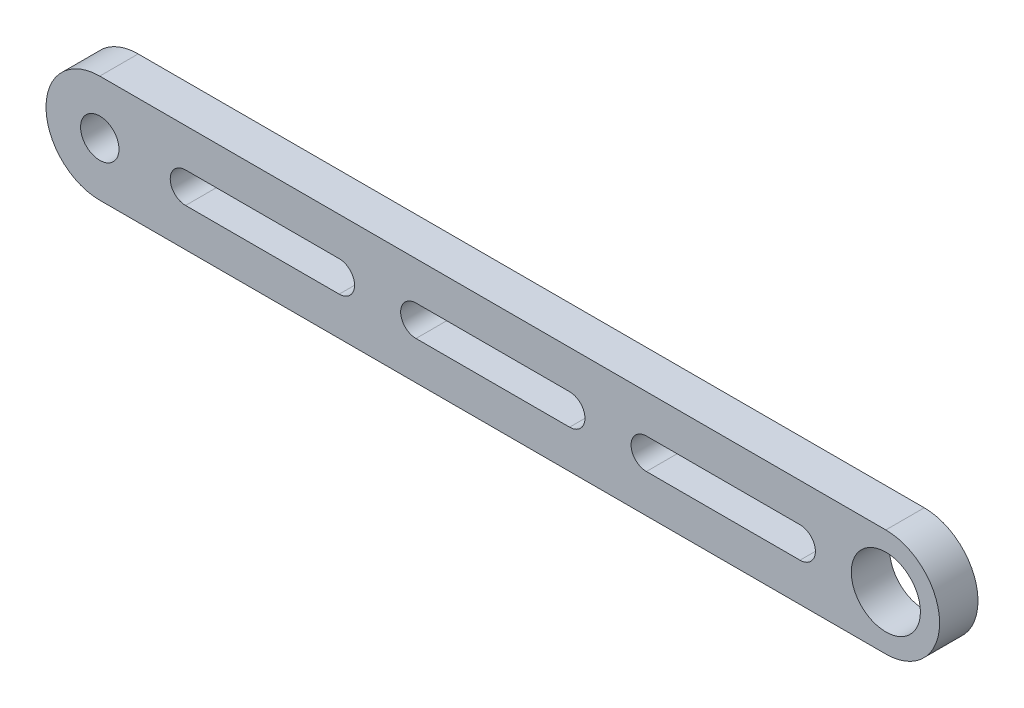
from build123d import *

# Parameters (mm, degrees)
SKETCH_2_R                 = 4.5
EXTRUDE_1_DEPTH            = 2.5
CUT_EXTRUDE_1_DEPTH        = 10
PATTERN_LINEAR_1_COUNT     = 2
PATTERN_LINEAR_1_PITCH     = 30
PATTERN_LINEAR_1_COL_COUNT = 2
PATTERN_LINEAR_1_COL_PITCH = 30
EXTRUDE_START              = -5
SKETCH_5_R                 = 4.5
SKETCH_5_R_2               = 2.5
EXTRUDE_3_DEPTH            = 5


with BuildPart() as part:
    # 草图2 → 凸台-拉伸1 (new, symmetric)
    with BuildSketch(Plane.XY):
        with BuildLine():
            Line((-51.175, 7), (51.175, 7))
            ThreePointArc((51.175, 7), (58.175, 0), (51.175, -7))
            Line((51.175, -7), (-51.175, -7))
            ThreePointArc((-51.175, -7), (-58.175, 0), (-51.175, 7))
        make_face()
        with Locations((51.175, 0)):
            Circle(SKETCH_2_R, mode=Mode.SUBTRACT)
        with Locations((-51.175, 0)):
            Circle(SKETCH_2_R, mode=Mode.SUBTRACT)
    extrude(amount=EXTRUDE_1_DEPTH, both=True)

    # 草图3 → 切除-拉伸1 (cut)
    with BuildSketch(Plane.XY.offset(2.5)):
        with BuildLine():
            Line((-10, 2), (10, 2))
            ThreePointArc((10, 2), (12, 0), (10, -2))
            Line((10, -2), (-10, -2))
            ThreePointArc((-10, -2), (-12, 0), (-10, 2))
        make_face()
    cut_extrude_1 = extrude(amount=-CUT_EXTRUDE_1_DEPTH, mode=Mode.SUBTRACT)

    # 阵列(线性)1: 切除-拉伸1 ×2
    with Locations(*[(-i * PATTERN_LINEAR_1_PITCH, 0, 0) for i in range(1, PATTERN_LINEAR_1_COUNT)]):
        add(cut_extrude_1, mode=Mode.SUBTRACT)

    # 阵列(线性)1 col: 切除-拉伸1 ×2
    with Locations(*[(i * PATTERN_LINEAR_1_COL_PITCH, 0, 0) for i in range(1, PATTERN_LINEAR_1_COL_COUNT)]):
        add(cut_extrude_1, mode=Mode.SUBTRACT)

    # 草图5 → 凸台-拉伸3 (add)
    with BuildSketch(Plane.XY.offset(2.5).offset(EXTRUDE_START)):
        with Locations((-51.175, 0)):
            Circle(SKETCH_5_R)
        with Locations((-51.175, 0)):
            Circle(SKETCH_5_R_2, mode=Mode.SUBTRACT)
    extrude(amount=EXTRUDE_3_DEPTH)


solid = part.part
